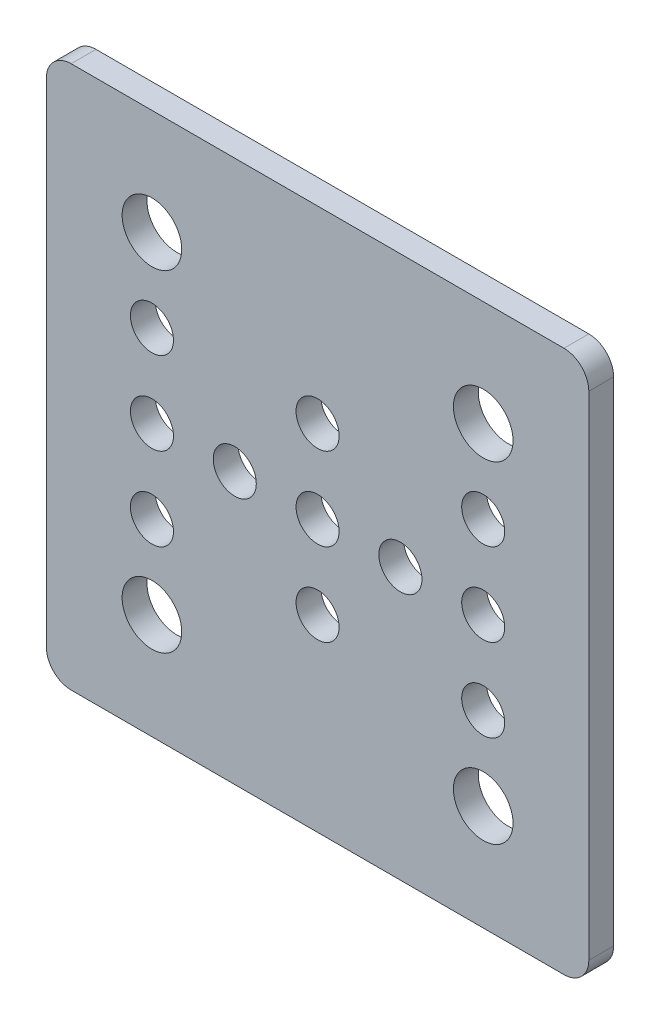
from build123d import *

# Parameters (mm, degrees)
SKETCH1_W           = 65.5
SKETCH1_H           = 65.5
BOSS_EXTRUDE1_DEPTH = 3
CUT_EXTRUDE1_REACH  = 48.413
SKETCH2_R           = 2.6
SKETCH2_R_2         = 3.6
FILLET1_R           = 3


with BuildPart() as part:
    # Sketch1 → Boss-Extrude1 (new body)
    with BuildSketch(Plane.XY):
        Rectangle(SKETCH1_W, SKETCH1_H)
    extrude(amount=BOSS_EXTRUDE1_DEPTH)

    # Sketch2 → Cut-Extrude1 (cut, up to next)
    with BuildSketch(Plane.XY.offset(3), mode=Mode.PRIVATE) as cut_extrude1_sk1:
        Circle(SKETCH2_R)
    cut_extrude1_tool1 = extrude(cut_extrude1_sk1.sketch, amount=-CUT_EXTRUDE1_REACH, mode=Mode.PRIVATE) & part.part
    # Sketch2 → Cut-Extrude1 (cut, up to next)
    with BuildSketch(Plane.XY.offset(3), mode=Mode.PRIVATE) as cut_extrude1_sk2:
        with Locations((10, 0)):
            Circle(SKETCH2_R)
    cut_extrude1_tool2 = extrude(cut_extrude1_sk2.sketch, amount=-CUT_EXTRUDE1_REACH, mode=Mode.PRIVATE) & part.part
    # Sketch2 → Cut-Extrude1 (cut, up to next)
    with BuildSketch(Plane.XY.offset(3), mode=Mode.PRIVATE) as cut_extrude1_sk3:
        with Locations((20, 0)):
            Circle(SKETCH2_R)
    cut_extrude1_tool3 = extrude(cut_extrude1_sk3.sketch, amount=-CUT_EXTRUDE1_REACH, mode=Mode.PRIVATE) & part.part
    # Sketch2 → Cut-Extrude1 (cut, up to next)
    with BuildSketch(Plane.XY.offset(3), mode=Mode.PRIVATE) as cut_extrude1_sk4:
        with Locations((0, -10)):
            Circle(SKETCH2_R)
    cut_extrude1_tool4 = extrude(cut_extrude1_sk4.sketch, amount=-CUT_EXTRUDE1_REACH, mode=Mode.PRIVATE) & part.part
    # Sketch2 → Cut-Extrude1 (cut, up to next)
    with BuildSketch(Plane.XY.offset(3), mode=Mode.PRIVATE) as cut_extrude1_sk5:
        with Locations((20, -10)):
            Circle(SKETCH2_R)
    cut_extrude1_tool5 = extrude(cut_extrude1_sk5.sketch, amount=-CUT_EXTRUDE1_REACH, mode=Mode.PRIVATE) & part.part
    # Sketch2 → Cut-Extrude1 (cut, up to next)
    with BuildSketch(Plane.XY.offset(3), mode=Mode.PRIVATE) as cut_extrude1_sk6:
        with Locations((20, 10)):
            Circle(SKETCH2_R)
    cut_extrude1_tool6 = extrude(cut_extrude1_sk6.sketch, amount=-CUT_EXTRUDE1_REACH, mode=Mode.PRIVATE) & part.part
    # Sketch2 → Cut-Extrude1 (cut, up to next)
    with BuildSketch(Plane.XY.offset(3), mode=Mode.PRIVATE) as cut_extrude1_sk7:
        with Locations((0, 10)):
            Circle(SKETCH2_R)
    cut_extrude1_tool7 = extrude(cut_extrude1_sk7.sketch, amount=-CUT_EXTRUDE1_REACH, mode=Mode.PRIVATE) & part.part
    # Sketch2 → Cut-Extrude1 (cut, up to next)
    with BuildSketch(Plane.XY.offset(3), mode=Mode.PRIVATE) as cut_extrude1_sk8:
        with Locations((-20, -10)):
            Circle(SKETCH2_R)
    cut_extrude1_tool8 = extrude(cut_extrude1_sk8.sketch, amount=-CUT_EXTRUDE1_REACH, mode=Mode.PRIVATE) & part.part
    # Sketch2 → Cut-Extrude1 (cut, up to next)
    with BuildSketch(Plane.XY.offset(3), mode=Mode.PRIVATE) as cut_extrude1_sk9:
        with Locations((-20, 10)):
            Circle(SKETCH2_R)
    cut_extrude1_tool9 = extrude(cut_extrude1_sk9.sketch, amount=-CUT_EXTRUDE1_REACH, mode=Mode.PRIVATE) & part.part
    # Sketch2 → Cut-Extrude1 (cut, up to next)
    with BuildSketch(Plane.XY.offset(3), mode=Mode.PRIVATE) as cut_extrude1_sk10:
        with Locations((-20, 0)):
            Circle(SKETCH2_R)
    cut_extrude1_tool10 = extrude(cut_extrude1_sk10.sketch, amount=-CUT_EXTRUDE1_REACH, mode=Mode.PRIVATE) & part.part
    # Sketch2 → Cut-Extrude1 (cut, up to next)
    with BuildSketch(Plane.XY.offset(3), mode=Mode.PRIVATE) as cut_extrude1_sk11:
        with Locations((-10, 0)):
            Circle(SKETCH2_R)
    cut_extrude1_tool11 = extrude(cut_extrude1_sk11.sketch, amount=-CUT_EXTRUDE1_REACH, mode=Mode.PRIVATE) & part.part
    # Sketch2 → Cut-Extrude1 (cut, up to next)
    with BuildSketch(Plane.XY.offset(3), mode=Mode.PRIVATE) as cut_extrude1_sk12:
        with Locations((-20, 20)):
            Circle(SKETCH2_R_2)
    cut_extrude1_tool12 = extrude(cut_extrude1_sk12.sketch, amount=-CUT_EXTRUDE1_REACH, mode=Mode.PRIVATE) & part.part
    # Sketch2 → Cut-Extrude1 (cut, up to next)
    with BuildSketch(Plane.XY.offset(3), mode=Mode.PRIVATE) as cut_extrude1_sk13:
        with Locations((20, 20)):
            Circle(SKETCH2_R_2)
    cut_extrude1_tool13 = extrude(cut_extrude1_sk13.sketch, amount=-CUT_EXTRUDE1_REACH, mode=Mode.PRIVATE) & part.part
    # Sketch2 → Cut-Extrude1 (cut, up to next)
    with BuildSketch(Plane.XY.offset(3), mode=Mode.PRIVATE) as cut_extrude1_sk14:
        with Locations((20, -20)):
            Circle(SKETCH2_R_2)
    cut_extrude1_tool14 = extrude(cut_extrude1_sk14.sketch, amount=-CUT_EXTRUDE1_REACH, mode=Mode.PRIVATE) & part.part
    # Sketch2 → Cut-Extrude1 (cut, up to next)
    with BuildSketch(Plane.XY.offset(3), mode=Mode.PRIVATE) as cut_extrude1_sk15:
        with Locations((-20, -20)):
            Circle(SKETCH2_R_2)
    cut_extrude1_tool15 = extrude(cut_extrude1_sk15.sketch, amount=-CUT_EXTRUDE1_REACH, mode=Mode.PRIVATE) & part.part
    add(cut_extrude1_tool1.solids().sort_by_distance((0, 0, 3))[0], mode=Mode.SUBTRACT)
    add(cut_extrude1_tool2.solids().sort_by_distance((10, 0, 3))[0], mode=Mode.SUBTRACT)
    add(cut_extrude1_tool3.solids().sort_by_distance((20, 0, 3))[0], mode=Mode.SUBTRACT)
    add(cut_extrude1_tool4.solids().sort_by_distance((0, -10, 3))[0], mode=Mode.SUBTRACT)
    add(cut_extrude1_tool5.solids().sort_by_distance((20, -10, 3))[0], mode=Mode.SUBTRACT)
    add(cut_extrude1_tool6.solids().sort_by_distance((20, 10, 3))[0], mode=Mode.SUBTRACT)
    add(cut_extrude1_tool7.solids().sort_by_distance((0, 10, 3))[0], mode=Mode.SUBTRACT)
    add(cut_extrude1_tool8.solids().sort_by_distance((-20, -10, 3))[0], mode=Mode.SUBTRACT)
    add(cut_extrude1_tool9.solids().sort_by_distance((-20, 10, 3))[0], mode=Mode.SUBTRACT)
    add(cut_extrude1_tool10.solids().sort_by_distance((-20, 0, 3))[0], mode=Mode.SUBTRACT)
    add(cut_extrude1_tool11.solids().sort_by_distance((-10, 0, 3))[0], mode=Mode.SUBTRACT)
    add(cut_extrude1_tool12.solids().sort_by_distance((-20, 20, 3))[0], mode=Mode.SUBTRACT)
    add(cut_extrude1_tool13.solids().sort_by_distance((20, 20, 3))[0], mode=Mode.SUBTRACT)
    add(cut_extrude1_tool14.solids().sort_by_distance((20, -20, 3))[0], mode=Mode.SUBTRACT)
    add(cut_extrude1_tool15.solids().sort_by_distance((-20, -20, 3))[0], mode=Mode.SUBTRACT)

    # Fillet1
    fillet1_edges = [part.edges().sort_by_distance(p)[0] for p in [
        (-32.75, 32.75, 1.5),
        (-32.75, -32.75, 1.5),
        (32.75, -32.75, 1.5),
        (32.75, 32.75, 1.5),
    ]]
    fillet(fillet1_edges, radius=FILLET1_R)


solid = part.part
